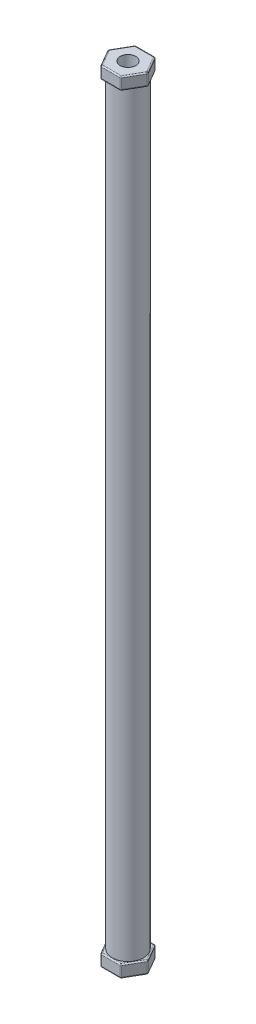
from build123d import *

# Parameters (mm, degrees)
SKETCH1_R            = 6.35
SKETCH1_R_2          = 3.175
BOSS_EXTRUDE1_DEPTH  = 304.8
SKETCH2_R            = 3.175
BOSS_EXTRUDE2_DEPTH  = 5
FILLET1_R            = 0.5
FILLET1_OF_MIRROR1_R = 0.5


with BuildPart() as part:
    # Sketch1 → Boss-Extrude1 (new body)
    with BuildSketch(Plane(origin=(0, 0, 0), x_dir=(1, 0, 0), z_dir=(0, 1, 0))):
        with Locations(Location((0, 0, 0), (0, 0, 90))):
            Circle(SKETCH1_R)
        with Locations(Location((0, 0, 0), (0, 0, 90))):
            Circle(SKETCH1_R_2, mode=Mode.SUBTRACT)
    extrude(amount=BOSS_EXTRUDE1_DEPTH)

    # Sketch2 → Boss-Extrude2 (add)
    with BuildSketch(Plane(origin=(0, 304.8, 0), x_dir=(1, 0, 0), z_dir=(0, 1, 0))):
        Polygon((-8.065583261, 0), (-4.03279163, -6.985), (4.03279163, -6.985), (8.065583261, 0), (4.03279163, 6.985), (-4.03279163, 6.985), align=None)
        with Locations(Location((0, 0, 0), (0, 0, 90))):
            Circle(SKETCH2_R, mode=Mode.SUBTRACT)
    boss_extrude2 = extrude(amount=BOSS_EXTRUDE2_DEPTH)

    # Fillet1
    fillet1_edges = [part.edges().sort_by_distance(p)[0] for p in [
        (-6.049187445, 309.8, -3.4925),
        (-6.049187445, 309.8, 3.4925),
        (0, 309.8, 6.985),
        (6.049187445, 309.8, 3.4925),
        (6.049187445, 309.8, -3.4925),
        (0, 309.8, -6.985),
        (-6.049187445, 304.8, -3.4925),
        (-4.03279163, 307.3, -6.985),
        (-6.049187445, 304.8, 3.4925),
        (-8.065583261, 307.3, 0),
        (0, 304.8, 6.985),
        (-4.03279163, 307.3, 6.985),
        (6.049187445, 304.8, 3.4925),
        (4.03279163, 307.3, 6.985),
        (6.049187445, 304.8, -3.4925),
        (8.065583261, 307.3, 0),
        (0, 304.8, -6.985),
        (4.03279163, 307.3, -6.985),
    ]]
    fillet(fillet1_edges, radius=FILLET1_R)

    # Mirror1: Boss-Extrude2 across plane
    add(boss_extrude2.mirror(Plane.ZX.offset(152.4)))

    # Fillet1 of Mirror1
    fillet1_of_mirror1_edges = [part.edges().sort_by_distance(p)[0] for p in [
        (-6.049187445, -5, -3.4925),
        (-6.049187445, -5, 3.4925),
        (0, -5, 6.985),
        (6.049187445, -5, 3.4925),
        (6.049187445, -5, -3.4925),
        (0, -5, -6.985),
        (-6.049187445, 0, -3.4925),
        (-4.03279163, -2.5, -6.985),
        (-6.049187445, 0, 3.4925),
        (-8.065583261, -2.5, 0),
        (0, 0, 6.985),
        (-4.03279163, -2.5, 6.985),
        (6.049187445, 0, 3.4925),
        (4.03279163, -2.5, 6.985),
        (6.049187445, 0, -3.4925),
        (8.065583261, -2.5, 0),
        (0, 0, -6.985),
        (4.03279163, -2.5, -6.985),
    ]]
    fillet(fillet1_of_mirror1_edges, radius=FILLET1_OF_MIRROR1_R)


solid = part.part
